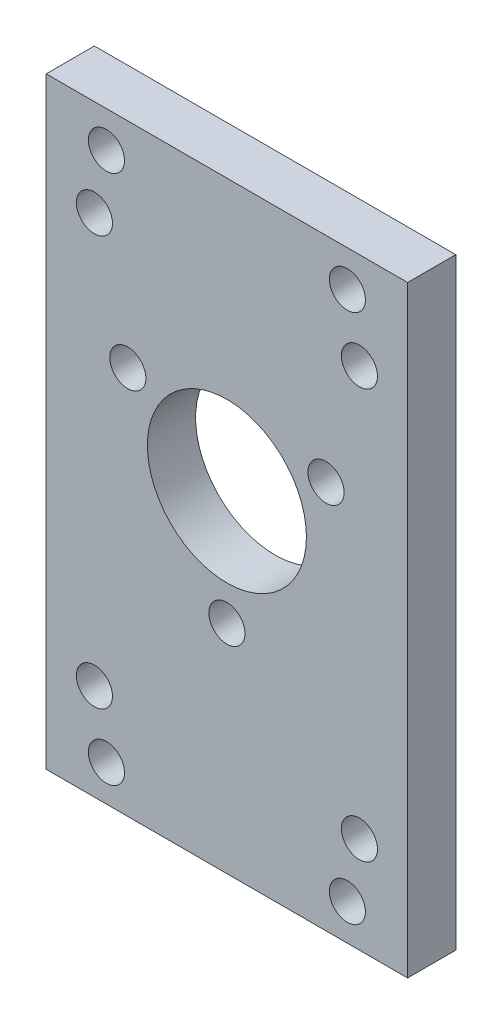
from build123d import *

# Parameters (mm, degrees)
SKETCH_1_W          = 30
SKETCH_1_H          = 50
SKETCH_1_R          = 6.6
SKETCH_1_R_2        = 1.5
EXTRUDE_1_DEPTH     = 4
SKETCH_2_R          = 1.5
CUT_EXTRUDE_1_DEPTH = 59.446556785


with BuildPart() as part:
    # 草图1 → 凸台-拉伸1 (new body)
    with BuildSketch(Plane.XY):
        with Locations((15, 25)):
            Rectangle(SKETCH_1_W, SKETCH_1_H)
        with Locations((15, 27.5)):
            Circle(SKETCH_1_R, mode=Mode.SUBTRACT)
        with Locations((23.227241336, 32.25)):
            Circle(SKETCH_1_R_2, mode=Mode.SUBTRACT)
        with Locations((15, 18)):
            Circle(SKETCH_1_R_2, mode=Mode.SUBTRACT)
        with Locations((6.772758664, 32.25)):
            Circle(SKETCH_1_R_2, mode=Mode.SUBTRACT)
        with Locations((5, 47)):
            Circle(SKETCH_1_R_2, mode=Mode.SUBTRACT)
        with Locations((25, 47)):
            Circle(SKETCH_1_R_2, mode=Mode.SUBTRACT)
        with Locations((5, 3)):
            Circle(SKETCH_1_R_2, mode=Mode.SUBTRACT)
        with Locations((25, 3)):
            Circle(SKETCH_1_R_2, mode=Mode.SUBTRACT)
    extrude(amount=EXTRUDE_1_DEPTH)

    # 草图2 → 切除-拉伸1 (cut, through all)
    with BuildSketch(Plane.XY.offset(4)):
        with Locations((4, 42)):
            Circle(SKETCH_2_R)
        with Locations((26, 42)):
            Circle(SKETCH_2_R)
        with Locations((26, 8)):
            Circle(SKETCH_2_R)
        with Locations((4, 8)):
            Circle(SKETCH_2_R)
    extrude(amount=-CUT_EXTRUDE_1_DEPTH, mode=Mode.SUBTRACT)


solid = part.part
